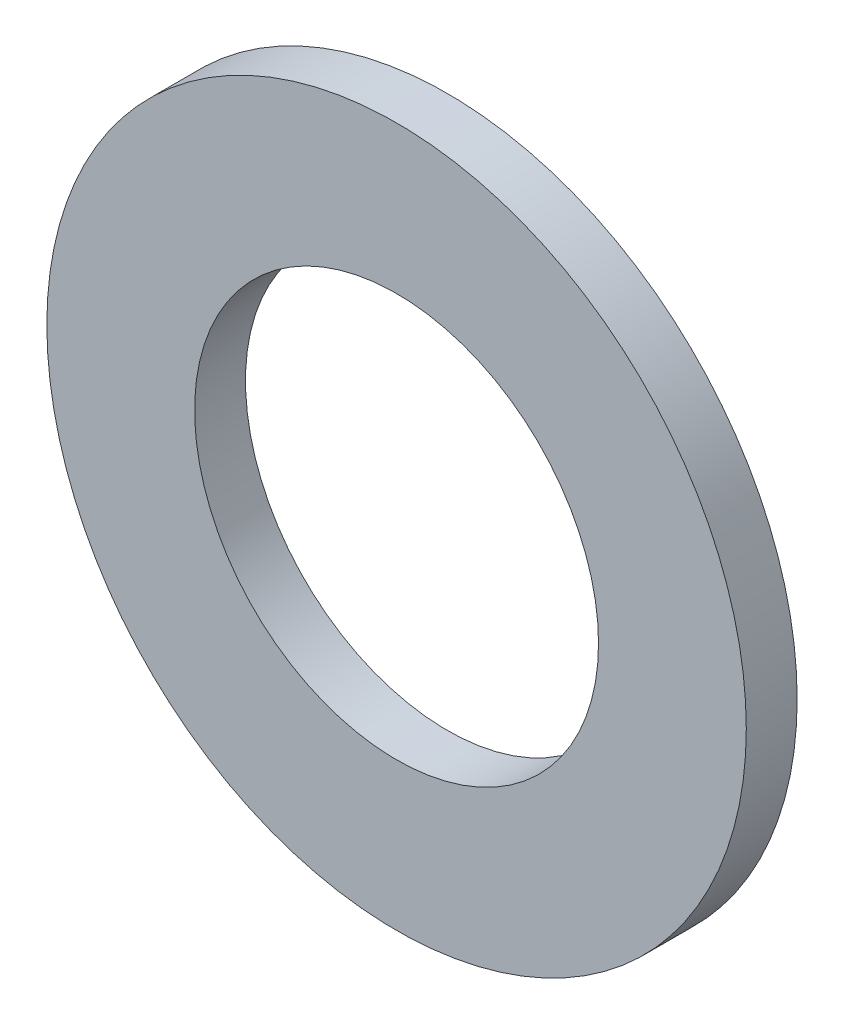
from build123d import *

# Parameters (mm, degrees)
SKETCH1_R                    = 8.73125
SKETCH1_R_2                  = 4.365625
EXTRUDE1_DEPTH               = 1.27
X_0_397_DIAMETER_HOLE1_D     = 10.0838
X_0_397_DIAMETER_HOLE1_DEPTH = 12.7
X_0_397_DIAMETER_HOLE1_TIP   = 3.029479155


with BuildPart() as part:
    # Sketch1 → Extrude1 (new body)
    with BuildSketch(Plane.XY):
        Circle(SKETCH1_R)
        Circle(SKETCH1_R_2, mode=Mode.SUBTRACT)
    extrude(amount=-EXTRUDE1_DEPTH)

    # X (0.397) Diameter Hole1
    with Locations(Plane.XY):
        with Locations((0, 0)):
            Hole(X_0_397_DIAMETER_HOLE1_D / 2, depth=X_0_397_DIAMETER_HOLE1_DEPTH)
            with Locations((0, 0, -(X_0_397_DIAMETER_HOLE1_DEPTH + X_0_397_DIAMETER_HOLE1_TIP / 2))):  # 118° drill point
                Cone(0, X_0_397_DIAMETER_HOLE1_D / 2, X_0_397_DIAMETER_HOLE1_TIP, mode=Mode.SUBTRACT)


solid = part.part
